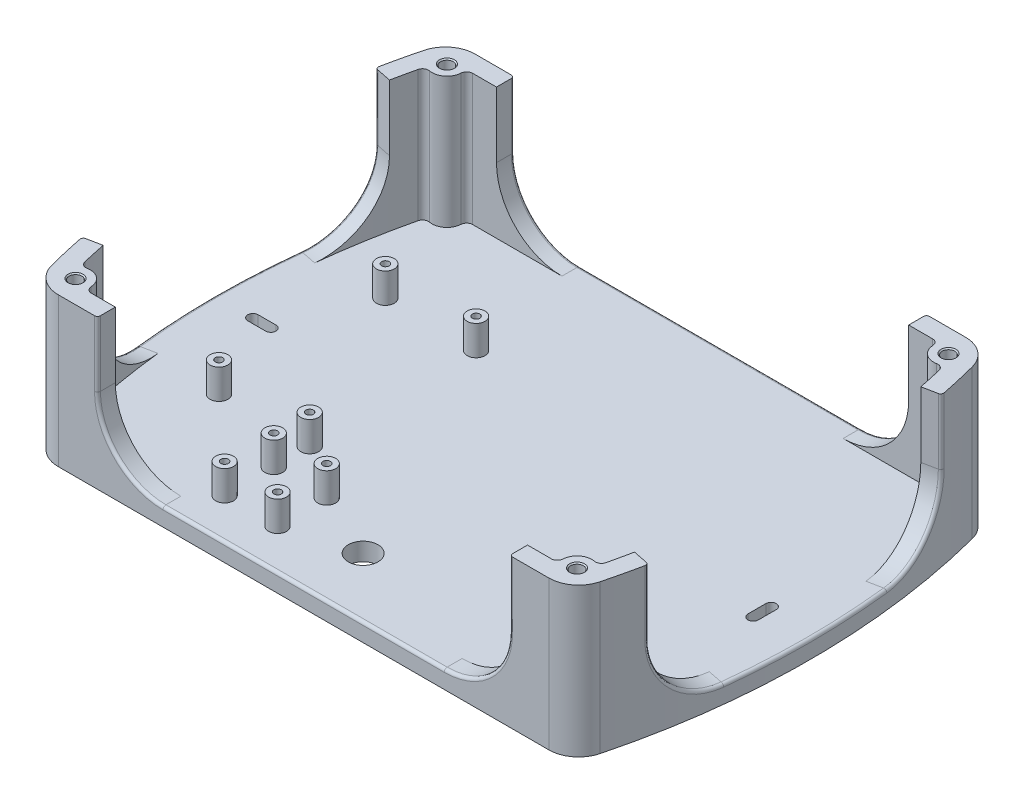
from build123d import *

# Parameters (mm, degrees)
BOSS_EXTRUDE1_DEPTH                    = 50
FILLET5_R                              = 10
SHELL1_T                               = -6
SKETCH18_R                             = 5
BOSS_EXTRUDE2_DEPTH                    = 44
CBORE_FOR_M5_HEX_HEAD_BOLT1_AT_2_COUNT = 2
CBORE_FOR_M5_HEX_HEAD_BOLT1_AT_2_PITCH = 168.432236159
CBORE_FOR_M5_HEX_HEAD_BOLT1_AT_3_COUNT = 2
CBORE_FOR_M5_HEX_HEAD_BOLT1_AT_3_PITCH = 209.595653903
CBORE_FOR_M5_HEX_HEAD_BOLT1_AT_4_COUNT = 2
CBORE_FOR_M5_HEX_HEAD_BOLT1_AT_4_PITCH = 124.74341649
FILLET6_R                              = 2
SKETCH21_R                             = 3
BOSS_EXTRUDE3_DEPTH                    = 10
LPATTERN1_COUNT                        = 2
LPATTERN1_PITCH                        = 30.48
LPATTERN1_COUNT_DIR2                   = 2
LPATTERN1_PITCH_DIR2                   = 55.88
SKETCH21_3_R                           = 3
BOSS_EXTRUDE4_DEPTH                    = 10
LPATTERN3_COUNT                        = 2
LPATTERN3_PITCH                        = 16.51
LPATTERN3_COUNT_DIR2                   = 2
LPATTERN3_PITCH_DIR2                   = 17.78
LPATTERN3_2_COUNT                      = 2
LPATTERN3_2_PITCH                      = 16.51
LPATTERN3_2_COUNT_DIR2                 = 2
LPATTERN3_2_PITCH_DIR2                 = 17.78
SKETCH26_R                             = 5
CUT_EXTRUDE5_DEPTH                     = 130.753612831
CUT_EXTRUDE7_DEPTH                     = 130.753612831
CUT_EXTRUDE8_DEPTH                     = 130.753612831
CUT_EXTRUDE9_START                     = -44
SKETCH27_W                             = 138.43223616
SKETCH27_H                             = 6
CUT_EXTRUDE9_DEPTH                     = 44
FILLET7_R                              = 22
FILLET8_R                              = 1


with BuildPart() as part:
    # Sketch1 → Boss-Extrude1 (new body)
    with BuildSketch(Plane(origin=(0, 0, 0), x_dir=(1, 0, 0), z_dir=(0, 1, 0))):
        with BuildLine():
            Line((-90, 70), (90, 70))
            ThreePointArc((90, 70), (100, 0), (90, -70))
            Line((90, -70), (-90, -70))
            ThreePointArc((-90, -70), (-100, 0), (-90, 70))
        make_face()
    extrude(amount=BOSS_EXTRUDE1_DEPTH)

    # Fillet5
    fillet5_edges = [part.edges().sort_by_distance(p)[0] for p in [
        (90, 25, 70),
        (-90, 25, 70),
        (-90, 25, -70),
        (90, 25, -70),
    ]]
    fillet(fillet5_edges, radius=FILLET5_R)

    # Shell1
    shell1_openings = [part.faces().sort_by_distance(p)[0] for p in [
        (0, 50, 0),
    ]]
    offset(amount=SHELL1_T, openings=shell1_openings, kind=Kind.INTERSECTION)

    # Sketch18 → Boss-Extrude2 (add)
    with BuildSketch(Plane(origin=(0, 50, 0), x_dir=(1, 0, 0), z_dir=(0, 1, 0))):
        with Locations((-84.21611808, 62.371708245)):
            Circle(SKETCH18_R)
        with Locations((84.21611808, 62.371708245)):
            Circle(SKETCH18_R)
        with Locations((84.21611808, -62.371708245)):
            Circle(SKETCH18_R)
        with Locations((-84.21611808, -62.371708245)):
            Circle(SKETCH18_R)
    extrude(amount=-BOSS_EXTRUDE2_DEPTH)

    # Sketch20 → CBORE for M5 Hex Head Bolt1 (revolve, cut)
    with BuildSketch(Plane(origin=(-84.21611808, 50, -62.371708245), x_dir=(0, 0, 1), z_dir=(1, 0, 0))):
        Polygon((0, 0), (0, 10.901290929), (1.5, 10), (1.5, 4.375), (2.125, 4.375), (2.125, 0.375), (2.5, 0), align=None)
    cbore_for_m5_hex_head_bolt1 = revolve(axis=Axis((-84.21611808, 56.35, -62.371708245), (0, -1, 0)), mode=Mode.SUBTRACT)

    # CBORE for M5 Hex Head Bolt1 at 2: CBORE for M5 Hex Head Bolt1 ×2
    with Locations(*[(i * CBORE_FOR_M5_HEX_HEAD_BOLT1_AT_2_PITCH, 0, 0) for i in range(1, CBORE_FOR_M5_HEX_HEAD_BOLT1_AT_2_COUNT)]):
        add(cbore_for_m5_hex_head_bolt1, mode=Mode.SUBTRACT)

    # CBORE for M5 Hex Head Bolt1 at 3: CBORE for M5 Hex Head Bolt1 ×2
    with Locations(*[Vector(0.8036055758898244, 0, 0.5951622286392036) * (i * CBORE_FOR_M5_HEX_HEAD_BOLT1_AT_3_PITCH) for i in range(1, CBORE_FOR_M5_HEX_HEAD_BOLT1_AT_3_COUNT)]):
        add(cbore_for_m5_hex_head_bolt1, mode=Mode.SUBTRACT)

    # CBORE for M5 Hex Head Bolt1 at 4: CBORE for M5 Hex Head Bolt1 ×2
    with Locations(*[(0, 0, i * CBORE_FOR_M5_HEX_HEAD_BOLT1_AT_4_PITCH) for i in range(1, CBORE_FOR_M5_HEX_HEAD_BOLT1_AT_4_COUNT)]):
        add(cbore_for_m5_hex_head_bolt1, mode=Mode.SUBTRACT)

    # Fillet6
    fillet6_edges = [part.edges().sort_by_distance(p)[0] for p in [
        (86.959392268, 28, -58.191463429),
        (79.488680511, 28, -64),
        (-79.488680511, 28, -64),
        (-86.959392268, 28, -58.191463429),
        (-86.959392268, 28, 58.191463429),
        (-79.488680511, 28, 64),
        (86.959392268, 28, 58.191463429),
        (79.488680511, 28, 64),
    ]]
    fillet(fillet6_edges, radius=FILLET6_R)

    # Sketch21 → Boss-Extrude3 (add)
    with BuildSketch(Plane(origin=(0, 6, 0), x_dir=(1, 0, 0), z_dir=(0, 1, 0))):
        with Locations(Location((-40, -27.94, 0), (0, 0, 90))):
            Circle(SKETCH21_R)
    boss_extrude3 = extrude(amount=BOSS_EXTRUDE3_DEPTH)

    # Sketch23 → M3x0.5 Tapped Hole2 (revolve, cut)
    with BuildSketch(Plane(origin=(-40, 16, 27.94), x_dir=(0, 0, 1), z_dir=(1, 0, 0))):
        Polygon((0, 0), (0, 8.251075774), (1.25, 7.5), (1.25, 0), align=None)
    m3x0_5_tapped_hole2 = revolve(axis=Axis((-40, 22.35, 27.94), (0, -1, 0)), mode=Mode.SUBTRACT)

    # LPattern1: Boss-Extrude3, M3x0.5 Tapped Hole2 2 × 2
    with Locations(*[(-i * LPATTERN1_PITCH, 0, -j * LPATTERN1_PITCH_DIR2) for i in range(LPATTERN1_COUNT) for j in range(LPATTERN1_COUNT_DIR2) if (i, j) != (0, 0)]):
        add(boss_extrude3)
        add(m3x0_5_tapped_hole2, mode=Mode.SUBTRACT)

    # Sketch26 → Cut-Extrude5 (cut, through all)
    with BuildSketch(Plane(origin=(0, 6, 0), x_dir=(1, 0, 0), z_dir=(0, 1, 0))):
        with Locations(Location((0, -50, 0), (0, 0, 270))):
            Circle(SKETCH26_R)
    extrude(amount=-CUT_EXTRUDE5_DEPTH, mode=Mode.SUBTRACT)

    # Sketch26<4> → Cut-Extrude7 (cut, through all)
    with BuildSketch(Plane(origin=(0, 6, 0), x_dir=(1, 0, 0), z_dir=(0, 1, 0))):
        with BuildLine():
            Line((-87, 1.7526), (-81, 1.7526))
            ThreePointArc((-81, 1.7526), (-79.2474, 0), (-81, -1.7526))
            Line((-81, -1.7526), (-87, -1.7526))
            ThreePointArc((-87, -1.7526), (-88.7526, 0), (-87, 1.7526))
        make_face()
    extrude(amount=-CUT_EXTRUDE7_DEPTH, mode=Mode.SUBTRACT)

    # Sketch26<5> → Cut-Extrude8 (cut, through all)
    with BuildSketch(Plane(origin=(0, 6, 0), x_dir=(1, 0, 0), z_dir=(0, 1, 0))):
        with BuildLine():
            Line((85.7526, 3), (85.7526, -3))
            ThreePointArc((85.7526, -3), (84, -4.7526), (82.2474, -3))
            Line((82.2474, -3), (82.2474, 3))
            ThreePointArc((82.2474, 3), (84, 4.7526), (85.7526, 3))
        make_face()
    extrude(amount=-CUT_EXTRUDE8_DEPTH, mode=Mode.SUBTRACT)

    # Sketch27 → Cut-Extrude9 (cut)
    with BuildSketch(Plane(origin=(0, 50, 0), x_dir=(1, 0, 0), z_dir=(0, 1, 0)).offset(CUT_EXTRUDE9_START)):
        with BuildLine():
            Line((-95.099067131, 49.258981836), (-89.21668952, 48.076766272))
            ThreePointArc((-89.21668952, 48.076766272), (-94, 0), (-89.21668952, -48.076766272))
            Line((-89.21668952, -48.076766272), (-95.099067131, -49.258981836))
            ThreePointArc((-95.099067131, -49.258981836), (-100, 0), (-95.099067131, 49.258981836))
        make_face()
        with Locations((0, 67)):
            Rectangle(SKETCH27_W, SKETCH27_H)
        with BuildLine():
            Line((95.099067131, 49.258981836), (89.21668952, 48.076766272))
            ThreePointArc((89.21668952, 48.076766272), (94, 0), (89.21668952, -48.076766272))
            Line((89.21668952, -48.076766272), (95.099067131, -49.258981836))
            ThreePointArc((95.099067131, -49.258981836), (100, 0), (95.099067131, 49.258981836))
        make_face()
        with Locations((0, -67)):
            Rectangle(SKETCH27_W, SKETCH27_H)
    extrude(amount=CUT_EXTRUDE9_DEPTH, mode=Mode.SUBTRACT)

    # Fillet7
    fillet7_edges = [part.edges().sort_by_distance(p)[0] for p in [
        (-92.157878325, 6, -48.667874054),
        (-92.157878325, 6, 48.667874054),
        (69.21611808, 6, -67),
        (-69.21611808, 6, -67),
        (92.157878325, 6, 48.667874054),
        (92.157878325, 6, -48.667874054),
        (69.21611808, 6, 67),
        (-69.21611808, 6, 67),
    ]]
    fillet(fillet7_edges, radius=FILLET7_R)

    # Fillet8
    fillet8_edges = [part.edges().sort_by_distance(p)[0] for p in [
        (100, 6, 0),
        (0, 6, -70),
        (-100, 6, 0),
        (0, 6, 70),
        (-69.21611808, 39, -70),
        (69.21611808, 39, -70),
        (95.099067131, 39, -49.258981836),
        (95.099067131, 39, 49.258981836),
        (69.21611808, 39, 70),
        (-69.21611808, 39, 70),
        (-95.099067131, 39, 49.258981836),
        (-95.099067131, 39, -49.258981836),
        (-62.772467266, 12.443650814, -70),
        (62.772467266, 12.443650814, -70),
        (96.288853322, 12.434442595, -42.916205905),
        (96.288853322, 12.434442595, 42.916205905),
        (62.772467266, 12.443650814, 70),
        (-62.772467266, 12.443650814, 70),
        (-96.288853322, 12.434442595, 42.916205905),
        (-96.288853322, 12.434442597, -42.916205906),
    ]]
    fillet(fillet8_edges, radius=FILLET8_R)


with BuildPart() as body_2:
    # Sketch21<3> → Boss-Extrude4 (new body)
    with BuildSketch(Plane(origin=(0, 6, 0), x_dir=(1, 0, 0), z_dir=(0, 1, 0))):
        with Locations(Location((-40, -40, 0), (0, 0, 270))):
            Circle(SKETCH21_3_R)
    boss_extrude4 = extrude(amount=BOSS_EXTRUDE4_DEPTH)

    # Sketch25 → M3x0.5 Tapped Hole3 (revolve, cut)
    with BuildSketch(Plane(origin=(-40, 16, 40), x_dir=(0, 0, 1), z_dir=(1, 0, 0))):
        Polygon((0, 0), (0, 8.251075774), (1.25, 7.5), (1.25, 0), align=None)
    m3x0_5_tapped_hole3 = revolve(axis=Axis((-40, 22.35, 40), (0, -1, 0)), mode=Mode.SUBTRACT)


with BuildPart() as lpattern3_1:
    # LPattern3: pattern copy
    add(boss_extrude4.moved(Location(Vector(0, 0, 1) * (0 * LPATTERN3_PITCH) + Vector(1, 0, 0) * (1 * LPATTERN3_PITCH_DIR2))))


with BuildPart() as lpattern3_2:
    # LPattern3: pattern copy
    add(boss_extrude4.moved(Location(Vector(0, 0, 1) * (1 * LPATTERN3_PITCH) + Vector(1, 0, 0) * (0 * LPATTERN3_PITCH_DIR2))))


with BuildPart() as lpattern3_3:
    # LPattern3: pattern copy
    add(boss_extrude4.moved(Location(Vector(0, 0, 1) * (1 * LPATTERN3_PITCH) + Vector(1, 0, 0) * (1 * LPATTERN3_PITCH_DIR2))))


with BuildPart() as lpattern3_2_tool:
    # LPattern3 2: M3x0.5 Tapped Hole3 2 × 2
    with Locations(*[(j * LPATTERN3_2_PITCH_DIR2, 0, i * LPATTERN3_2_PITCH) for i in range(LPATTERN3_2_COUNT) for j in range(LPATTERN3_2_COUNT_DIR2) if (i, j) != (0, 0)]):
        add(m3x0_5_tapped_hole3)


with BuildPart() as lpattern3_1_1:
    add(lpattern3_1.part)

    # LPattern3 2: cut by lpattern3_2_tool
    add(lpattern3_2_tool.part, mode=Mode.SUBTRACT)


with BuildPart() as lpattern3_2_1:
    add(lpattern3_2.part)

    # LPattern3 2: cut by lpattern3_2_tool
    add(lpattern3_2_tool.part, mode=Mode.SUBTRACT)


with BuildPart() as lpattern3_3_1:
    add(lpattern3_3.part)

    # LPattern3 2: cut by lpattern3_2_tool
    add(lpattern3_2_tool.part, mode=Mode.SUBTRACT)


solid = Compound([part.part, body_2.part, lpattern3_1_1.part, lpattern3_2_1.part, lpattern3_3_1.part])
